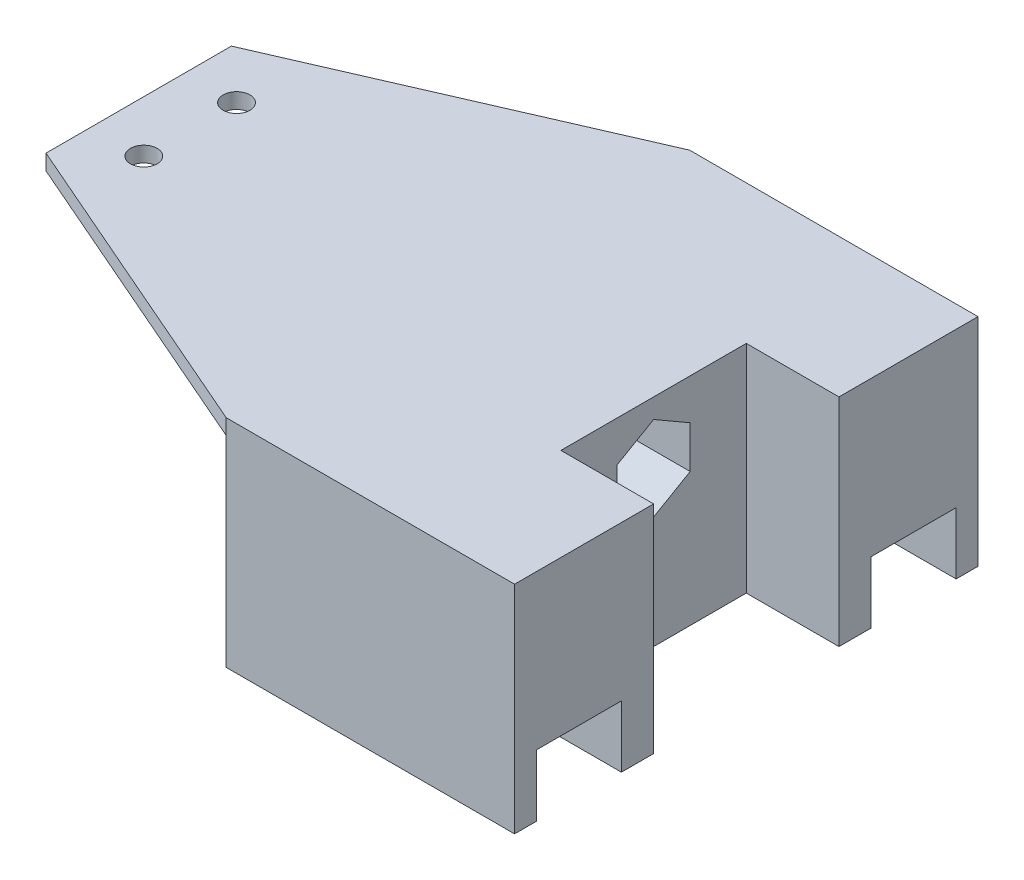
from build123d import *

# Parameters (mm, degrees)
BOSS_EXTRUDE1_DEPTH = 14
SKETCH2_W           = 18
SKETCH2_H           = 18
CUT_EXTRUDE1_DEPTH  = 21
SKETCH3_R           = 1.3
BOSS_EXTRUDE2_DEPTH = 1.5


with BuildPart() as part:
    # Sketch1 → Boss-Extrude1 (new, symmetric)
    with BuildSketch(Plane(origin=(0, 0, 0), x_dir=(0, 0, -1), z_dir=(1, 0, 0))):
        Polygon((-22.5, 0), (-22.5, 21), (22.5, 21), (22.5, 0), (20.375, 0), (20.375, 6), (12.125, 6), (12.125, 0), (-12.125, 0), (-12.125, 6), (-20.375, 6), (-20.375, 0), align=None)
        Polygon((0, 10.900813089), (3.55, 12.950406544), (3.55, 17.049593456), (0, 19.099186911), (-3.55, 17.049593456), (-3.55, 12.950406544), align=None, mode=Mode.SUBTRACT)
    extrude(amount=BOSS_EXTRUDE1_DEPTH, both=True)

    # Sketch2 → Cut-Extrude1 (cut)
    with BuildSketch(Plane(origin=(0, 21, 0), x_dir=(1, 0, 0), z_dir=(0, 1, 0))):
        with Locations((-14, 0)):
            Rectangle(SKETCH2_W, SKETCH2_H)
        with Locations((14, 0)):
            Rectangle(SKETCH2_W, SKETCH2_H)
    extrude(amount=-CUT_EXTRUDE1_DEPTH, mode=Mode.SUBTRACT)

    # Sketch3 → Boss-Extrude2 (add)
    with BuildSketch(Plane(origin=(0, 21, 0), x_dir=(1, 0, 0), z_dir=(0, 1, 0))):
        Polygon((-5, -9), (-5, 9), (-14, 22.5), (-45, 9), (-45, -9), (-14, -22.5), align=None)
        with Locations(Location((-40, 4.5, 0), (0, 0, 270))):
            Circle(SKETCH3_R, mode=Mode.SUBTRACT)
        with Locations(Location((-40, -4.5, 0), (0, 0, 90))):
            Circle(SKETCH3_R, mode=Mode.SUBTRACT)
    extrude(amount=-BOSS_EXTRUDE2_DEPTH)


solid = part.part
